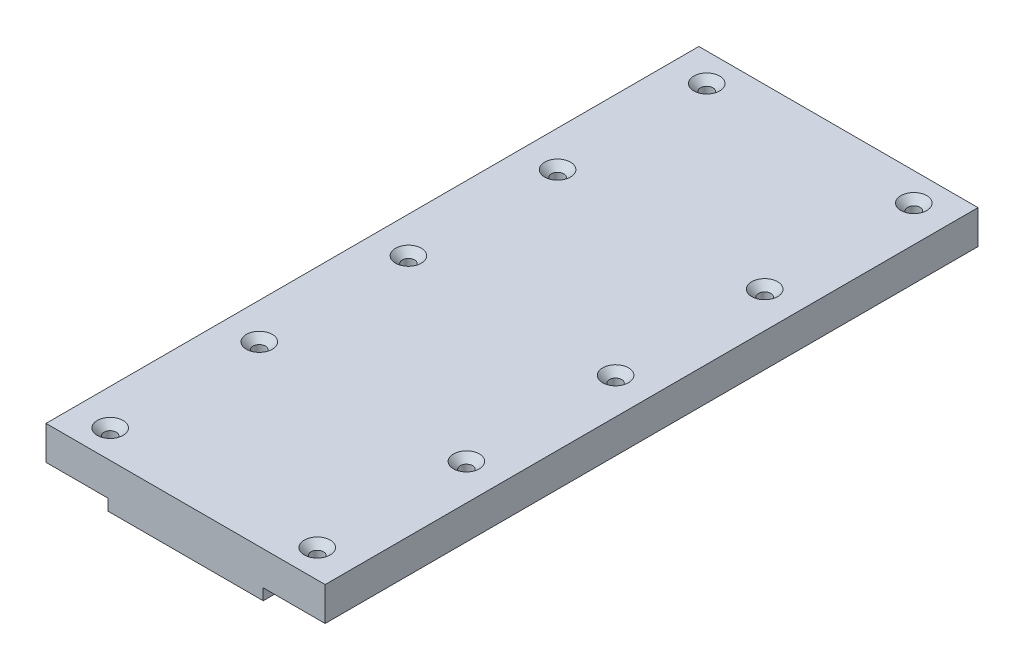
from build123d import *

# Parameters (mm, degrees)
SALIENTE_EXTRUIR1_DEPTH = 580
CORTAR_EXTRUIR1_REACH   = 634.063
CROQUIS2_R              = 5.5
CHAFL_N1_SIZE           = 6


with BuildPart() as part:
    # Croquis1 → Saliente-Extruir1 (new body)
    with BuildSketch(Plane.XY):
        Polygon((0, 0), (-55, 0), (-55, -10), (-193, -10), (-193, 0), (-248, 0), (-248, 30), (0, 30), align=None)
    extrude(amount=-SALIENTE_EXTRUIR1_DEPTH)

    # Croquis2 → Cortar-Extruir1 (cut, up to next)
    with BuildSketch(Plane(origin=(0, 30, 0), x_dir=(1, 0, 0), z_dir=(0, 1, 0)), mode=Mode.PRIVATE) as cortar_extruir1_sk1:
        with Locations(Location((-216, 555, 0), (0, 0, 270))):
            Circle(CROQUIS2_R)
    cortar_extruir1_tool1 = extrude(cortar_extruir1_sk1.sketch, amount=-CORTAR_EXTRUIR1_REACH, mode=Mode.PRIVATE) & part.part
    # Croquis2 → Cortar-Extruir1 (cut, up to next)
    with BuildSketch(Plane(origin=(0, 30, 0), x_dir=(1, 0, 0), z_dir=(0, 1, 0)), mode=Mode.PRIVATE) as cortar_extruir1_sk2:
        with Locations(Location((-32, 555, 0), (0, 0, 270))):
            Circle(CROQUIS2_R)
    cortar_extruir1_tool2 = extrude(cortar_extruir1_sk2.sketch, amount=-CORTAR_EXTRUIR1_REACH, mode=Mode.PRIVATE) & part.part
    # Croquis2 → Cortar-Extruir1 (cut, up to next)
    with BuildSketch(Plane(origin=(0, 30, 0), x_dir=(1, 0, 0), z_dir=(0, 1, 0)), mode=Mode.PRIVATE) as cortar_extruir1_sk3:
        with Locations(Location((-32, 422.5, 0), (0, 0, 270))):
            Circle(CROQUIS2_R)
    cortar_extruir1_tool3 = extrude(cortar_extruir1_sk3.sketch, amount=-CORTAR_EXTRUIR1_REACH, mode=Mode.PRIVATE) & part.part
    # Croquis2 → Cortar-Extruir1 (cut, up to next)
    with BuildSketch(Plane(origin=(0, 30, 0), x_dir=(1, 0, 0), z_dir=(0, 1, 0)), mode=Mode.PRIVATE) as cortar_extruir1_sk4:
        with Locations(Location((-32, 290, 0), (0, 0, 270))):
            Circle(CROQUIS2_R)
    cortar_extruir1_tool4 = extrude(cortar_extruir1_sk4.sketch, amount=-CORTAR_EXTRUIR1_REACH, mode=Mode.PRIVATE) & part.part
    # Croquis2 → Cortar-Extruir1 (cut, up to next)
    with BuildSketch(Plane(origin=(0, 30, 0), x_dir=(1, 0, 0), z_dir=(0, 1, 0)), mode=Mode.PRIVATE) as cortar_extruir1_sk5:
        with Locations(Location((-32, 157.5, 0), (0, 0, 270))):
            Circle(CROQUIS2_R)
    cortar_extruir1_tool5 = extrude(cortar_extruir1_sk5.sketch, amount=-CORTAR_EXTRUIR1_REACH, mode=Mode.PRIVATE) & part.part
    # Croquis2 → Cortar-Extruir1 (cut, up to next)
    with BuildSketch(Plane(origin=(0, 30, 0), x_dir=(1, 0, 0), z_dir=(0, 1, 0)), mode=Mode.PRIVATE) as cortar_extruir1_sk6:
        with Locations(Location((-32, 25, 0), (0, 0, 270))):
            Circle(CROQUIS2_R)
    cortar_extruir1_tool6 = extrude(cortar_extruir1_sk6.sketch, amount=-CORTAR_EXTRUIR1_REACH, mode=Mode.PRIVATE) & part.part
    # Croquis2 → Cortar-Extruir1 (cut, up to next)
    with BuildSketch(Plane(origin=(0, 30, 0), x_dir=(1, 0, 0), z_dir=(0, 1, 0)), mode=Mode.PRIVATE) as cortar_extruir1_sk7:
        with Locations(Location((-216, 422.5, 0), (0, 0, 270))):
            Circle(CROQUIS2_R)
    cortar_extruir1_tool7 = extrude(cortar_extruir1_sk7.sketch, amount=-CORTAR_EXTRUIR1_REACH, mode=Mode.PRIVATE) & part.part
    # Croquis2 → Cortar-Extruir1 (cut, up to next)
    with BuildSketch(Plane(origin=(0, 30, 0), x_dir=(1, 0, 0), z_dir=(0, 1, 0)), mode=Mode.PRIVATE) as cortar_extruir1_sk8:
        with Locations(Location((-216, 290, 0), (0, 0, 270))):
            Circle(CROQUIS2_R)
    cortar_extruir1_tool8 = extrude(cortar_extruir1_sk8.sketch, amount=-CORTAR_EXTRUIR1_REACH, mode=Mode.PRIVATE) & part.part
    # Croquis2 → Cortar-Extruir1 (cut, up to next)
    with BuildSketch(Plane(origin=(0, 30, 0), x_dir=(1, 0, 0), z_dir=(0, 1, 0)), mode=Mode.PRIVATE) as cortar_extruir1_sk9:
        with Locations(Location((-216, 157.5, 0), (0, 0, 270))):
            Circle(CROQUIS2_R)
    cortar_extruir1_tool9 = extrude(cortar_extruir1_sk9.sketch, amount=-CORTAR_EXTRUIR1_REACH, mode=Mode.PRIVATE) & part.part
    # Croquis2 → Cortar-Extruir1 (cut, up to next)
    with BuildSketch(Plane(origin=(0, 30, 0), x_dir=(1, 0, 0), z_dir=(0, 1, 0)), mode=Mode.PRIVATE) as cortar_extruir1_sk10:
        with Locations(Location((-216, 25, 0), (0, 0, 270))):
            Circle(CROQUIS2_R)
    cortar_extruir1_tool10 = extrude(cortar_extruir1_sk10.sketch, amount=-CORTAR_EXTRUIR1_REACH, mode=Mode.PRIVATE) & part.part
    add(cortar_extruir1_tool1.solids().sort_by_distance((-216, 30, -555))[0], mode=Mode.SUBTRACT)
    add(cortar_extruir1_tool2.solids().sort_by_distance((-32, 30, -555))[0], mode=Mode.SUBTRACT)
    add(cortar_extruir1_tool3.solids().sort_by_distance((-32, 30, -422.5))[0], mode=Mode.SUBTRACT)
    add(cortar_extruir1_tool4.solids().sort_by_distance((-32, 30, -290))[0], mode=Mode.SUBTRACT)
    add(cortar_extruir1_tool5.solids().sort_by_distance((-32, 30, -157.5))[0], mode=Mode.SUBTRACT)
    add(cortar_extruir1_tool6.solids().sort_by_distance((-32, 30, -25))[0], mode=Mode.SUBTRACT)
    add(cortar_extruir1_tool7.solids().sort_by_distance((-216, 30, -422.5))[0], mode=Mode.SUBTRACT)
    add(cortar_extruir1_tool8.solids().sort_by_distance((-216, 30, -290))[0], mode=Mode.SUBTRACT)
    add(cortar_extruir1_tool9.solids().sort_by_distance((-216, 30, -157.5))[0], mode=Mode.SUBTRACT)
    add(cortar_extruir1_tool10.solids().sort_by_distance((-216, 30, -25))[0], mode=Mode.SUBTRACT)

    # Chaflán1
    chafl_n1_edges = [part.edges().sort_by_distance(p)[0] for p in [
        (-32, 30, -30.5),
        (-216, 30, -428),
        (-216, 30, -295.5),
        (-216, 30, -163),
        (-32, 30, -163),
        (-32, 30, -295.5),
        (-32, 30, -428),
        (-32, 30, -560.5),
        (-216, 30, -30.5),
        (-216, 30, -560.5),
    ]]
    chamfer(chafl_n1_edges, length=CHAFL_N1_SIZE)


solid = part.part
